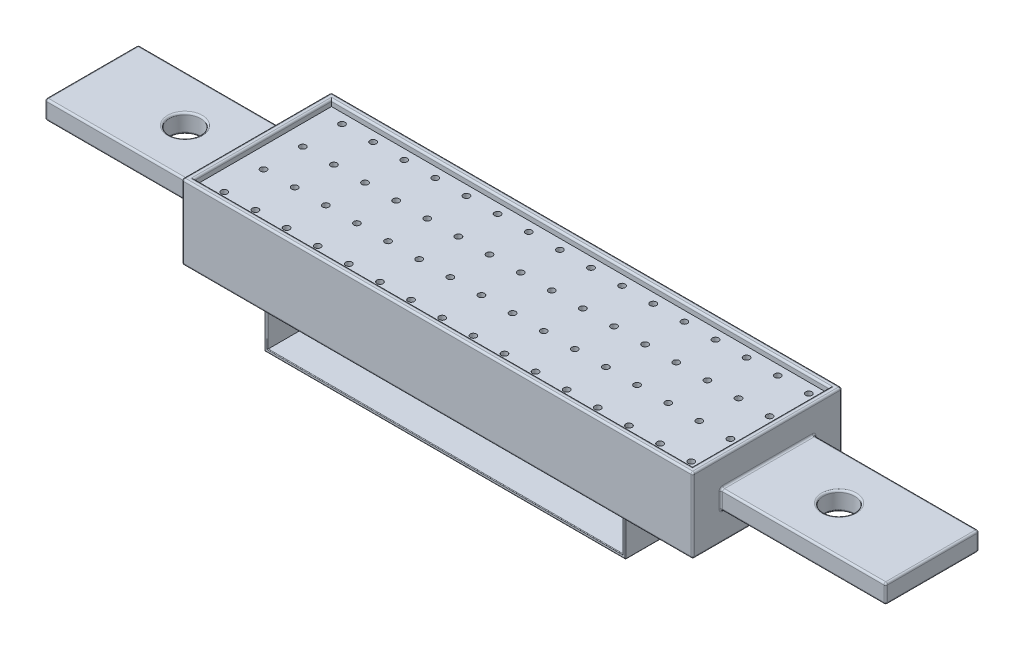
from build123d import *

# Parameters (mm, degrees)
SKETCH1_W           = 80
SKETCH1_H           = 22
SKETCH1_R           = 0.5
BOSS_EXTRUDE1_DEPTH = 10
BOSS_EXTRUDE2_START = -1
SKETCH6_W           = 82
SKETCH6_H           = 24
SKETCH6_W_2         = 80
SKETCH6_H_2         = 22
BOSS_EXTRUDE2_DEPTH = 12
SKETCH7_W           = 15
SKETCH7_H           = 3
BOSS_EXTRUDE3_DEPTH = 26.5
SKETCH8_R           = 2.5
CUT_EXTRUDE1_DEPTH  = 111.232726826
FILLET1_R           = 0.3
SKETCH10_W          = 58
SKETCH10_H          = 21
BOSS_EXTRUDE4_DEPTH = 7
SHELL1_T            = -0.5
FILLET2_R           = 0.1


with BuildPart() as part:
    # Sketch1 → Boss-Extrude1 (new body)
    with BuildSketch(Plane(origin=(0, 0, 0), x_dir=(1, 0, 0), z_dir=(0, 1, 0))):
        with Locations((40, 11)):
            Rectangle(SKETCH1_W, SKETCH1_H)
        with Locations(Location((78.276716264, 1.510550974, 0), (0, 0, 270))):
            Circle(SKETCH1_R, mode=Mode.SUBTRACT)
        with Locations(Location((73.276716264, 1.510550974, 0), (0, 0, 270))):
            Circle(SKETCH1_R, mode=Mode.SUBTRACT)
        with Locations(Location((68.276716264, 1.510550974, 0), (0, 0, 270))):
            Circle(SKETCH1_R, mode=Mode.SUBTRACT)
        with Locations(Location((63.276716264, 1.510550974, 0), (0, 0, 270))):
            Circle(SKETCH1_R, mode=Mode.SUBTRACT)
        with Locations(Location((58.276716264, 1.510550974, 0), (0, 0, 270))):
            Circle(SKETCH1_R, mode=Mode.SUBTRACT)
        with Locations(Location((53.276716264, 1.510550974, 0), (0, 0, 270))):
            Circle(SKETCH1_R, mode=Mode.SUBTRACT)
        with Locations(Location((48.276716264, 1.510550974, 0), (0, 0, 270))):
            Circle(SKETCH1_R, mode=Mode.SUBTRACT)
        with Locations(Location((43.276716264, 1.510550974, 0), (0, 0, 270))):
            Circle(SKETCH1_R, mode=Mode.SUBTRACT)
        with Locations(Location((38.276716264, 1.510550974, 0), (0, 0, 270))):
            Circle(SKETCH1_R, mode=Mode.SUBTRACT)
        with Locations(Location((33.276716264, 1.510550974, 0), (0, 0, 270))):
            Circle(SKETCH1_R, mode=Mode.SUBTRACT)
        with Locations(Location((28.276716264, 1.510550974, 0), (0, 0, 270))):
            Circle(SKETCH1_R, mode=Mode.SUBTRACT)
        with Locations(Location((23.276716264, 1.510550974, 0), (0, 0, 270))):
            Circle(SKETCH1_R, mode=Mode.SUBTRACT)
        with Locations(Location((18.276716264, 1.510550974, 0), (0, 0, 270))):
            Circle(SKETCH1_R, mode=Mode.SUBTRACT)
        with Locations(Location((13.276716264, 1.510550974, 0), (0, 0, 270))):
            Circle(SKETCH1_R, mode=Mode.SUBTRACT)
        with Locations(Location((8.276716264, 1.510550974, 0), (0, 0, 270))):
            Circle(SKETCH1_R, mode=Mode.SUBTRACT)
        with Locations(Location((3.276716264, 1.510550974, 0), (0, 0, 270))):
            Circle(SKETCH1_R, mode=Mode.SUBTRACT)
        with Locations(Location((73.276716264, 7.810550974, 0), (0, 0, 270))):
            Circle(SKETCH1_R, mode=Mode.SUBTRACT)
        with Locations(Location((68.276716264, 7.810550974, 0), (0, 0, 270))):
            Circle(SKETCH1_R, mode=Mode.SUBTRACT)
        with Locations(Location((63.276716264, 7.810550974, 0), (0, 0, 270))):
            Circle(SKETCH1_R, mode=Mode.SUBTRACT)
        with Locations(Location((58.276716264, 7.810550974, 0), (0, 0, 270))):
            Circle(SKETCH1_R, mode=Mode.SUBTRACT)
        with Locations(Location((53.276716264, 7.810550974, 0), (0, 0, 270))):
            Circle(SKETCH1_R, mode=Mode.SUBTRACT)
        with Locations(Location((48.276716264, 7.810550974, 0), (0, 0, 270))):
            Circle(SKETCH1_R, mode=Mode.SUBTRACT)
        with Locations(Location((43.276716264, 7.810550974, 0), (0, 0, 270))):
            Circle(SKETCH1_R, mode=Mode.SUBTRACT)
        with Locations(Location((38.276716264, 7.810550974, 0), (0, 0, 270))):
            Circle(SKETCH1_R, mode=Mode.SUBTRACT)
        with Locations(Location((33.276716264, 7.810550974, 0), (0, 0, 270))):
            Circle(SKETCH1_R, mode=Mode.SUBTRACT)
        with Locations(Location((28.276716264, 7.810550974, 0), (0, 0, 270))):
            Circle(SKETCH1_R, mode=Mode.SUBTRACT)
        with Locations(Location((23.276716264, 7.810550974, 0), (0, 0, 270))):
            Circle(SKETCH1_R, mode=Mode.SUBTRACT)
        with Locations(Location((18.276716264, 7.810550974, 0), (0, 0, 270))):
            Circle(SKETCH1_R, mode=Mode.SUBTRACT)
        with Locations(Location((13.276716264, 7.810550974, 0), (0, 0, 270))):
            Circle(SKETCH1_R, mode=Mode.SUBTRACT)
        with Locations(Location((8.276716264, 7.810550974, 0), (0, 0, 270))):
            Circle(SKETCH1_R, mode=Mode.SUBTRACT)
        with Locations(Location((3.276716264, 7.810550974, 0), (0, 0, 270))):
            Circle(SKETCH1_R, mode=Mode.SUBTRACT)
        with Locations(Location((73.276716264, 14.110550974, 0), (0, 0, 270))):
            Circle(SKETCH1_R, mode=Mode.SUBTRACT)
        with Locations(Location((68.276716264, 14.110550974, 0), (0, 0, 270))):
            Circle(SKETCH1_R, mode=Mode.SUBTRACT)
        with Locations(Location((63.276716264, 14.110550974, 0), (0, 0, 270))):
            Circle(SKETCH1_R, mode=Mode.SUBTRACT)
        with Locations(Location((58.276716264, 14.110550974, 0), (0, 0, 270))):
            Circle(SKETCH1_R, mode=Mode.SUBTRACT)
        with Locations(Location((53.276716264, 14.110550974, 0), (0, 0, 270))):
            Circle(SKETCH1_R, mode=Mode.SUBTRACT)
        with Locations(Location((48.276716264, 14.110550974, 0), (0, 0, 270))):
            Circle(SKETCH1_R, mode=Mode.SUBTRACT)
        with Locations(Location((43.276716264, 14.110550974, 0), (0, 0, 270))):
            Circle(SKETCH1_R, mode=Mode.SUBTRACT)
        with Locations(Location((38.276716264, 14.110550974, 0), (0, 0, 270))):
            Circle(SKETCH1_R, mode=Mode.SUBTRACT)
        with Locations(Location((33.276716264, 14.110550974, 0), (0, 0, 270))):
            Circle(SKETCH1_R, mode=Mode.SUBTRACT)
        with Locations(Location((28.276716264, 14.110550974, 0), (0, 0, 270))):
            Circle(SKETCH1_R, mode=Mode.SUBTRACT)
        with Locations(Location((23.276716264, 14.110550974, 0), (0, 0, 270))):
            Circle(SKETCH1_R, mode=Mode.SUBTRACT)
        with Locations(Location((18.276716264, 14.110550974, 0), (0, 0, 270))):
            Circle(SKETCH1_R, mode=Mode.SUBTRACT)
        with Locations(Location((13.276716264, 14.110550974, 0), (0, 0, 270))):
            Circle(SKETCH1_R, mode=Mode.SUBTRACT)
        with Locations(Location((8.276716264, 14.110550974, 0), (0, 0, 270))):
            Circle(SKETCH1_R, mode=Mode.SUBTRACT)
        with Locations(Location((3.276716264, 14.110550974, 0), (0, 0, 270))):
            Circle(SKETCH1_R, mode=Mode.SUBTRACT)
        with Locations(Location((73.276716264, 20.410550974, 0), (0, 0, 270))):
            Circle(SKETCH1_R, mode=Mode.SUBTRACT)
        with Locations(Location((68.276716264, 20.410550974, 0), (0, 0, 270))):
            Circle(SKETCH1_R, mode=Mode.SUBTRACT)
        with Locations(Location((63.276716264, 20.410550974, 0), (0, 0, 270))):
            Circle(SKETCH1_R, mode=Mode.SUBTRACT)
        with Locations(Location((58.276716264, 20.410550974, 0), (0, 0, 270))):
            Circle(SKETCH1_R, mode=Mode.SUBTRACT)
        with Locations(Location((53.276716264, 20.410550974, 0), (0, 0, 270))):
            Circle(SKETCH1_R, mode=Mode.SUBTRACT)
        with Locations(Location((48.276716264, 20.410550974, 0), (0, 0, 270))):
            Circle(SKETCH1_R, mode=Mode.SUBTRACT)
        with Locations(Location((43.276716264, 20.410550974, 0), (0, 0, 270))):
            Circle(SKETCH1_R, mode=Mode.SUBTRACT)
        with Locations(Location((38.276716264, 20.410550974, 0), (0, 0, 270))):
            Circle(SKETCH1_R, mode=Mode.SUBTRACT)
        with Locations(Location((33.276716264, 20.410550974, 0), (0, 0, 270))):
            Circle(SKETCH1_R, mode=Mode.SUBTRACT)
        with Locations(Location((28.276716264, 20.410550974, 0), (0, 0, 270))):
            Circle(SKETCH1_R, mode=Mode.SUBTRACT)
        with Locations(Location((23.276716264, 20.410550974, 0), (0, 0, 270))):
            Circle(SKETCH1_R, mode=Mode.SUBTRACT)
        with Locations(Location((18.276716264, 20.410550974, 0), (0, 0, 270))):
            Circle(SKETCH1_R, mode=Mode.SUBTRACT)
        with Locations(Location((13.276716264, 20.410550974, 0), (0, 0, 270))):
            Circle(SKETCH1_R, mode=Mode.SUBTRACT)
        with Locations(Location((8.276716264, 20.410550974, 0), (0, 0, 270))):
            Circle(SKETCH1_R, mode=Mode.SUBTRACT)
        with Locations(Location((3.276716264, 20.410550974, 0), (0, 0, 270))):
            Circle(SKETCH1_R, mode=Mode.SUBTRACT)
        with Locations(Location((78.276716264, 7.810550974, 0), (0, 0, 270))):
            Circle(SKETCH1_R, mode=Mode.SUBTRACT)
        with Locations(Location((78.276716264, 14.110550974, 0), (0, 0, 270))):
            Circle(SKETCH1_R, mode=Mode.SUBTRACT)
        with Locations(Location((78.276716264, 20.410550974, 0), (0, 0, 270))):
            Circle(SKETCH1_R, mode=Mode.SUBTRACT)
    extrude(amount=BOSS_EXTRUDE1_DEPTH)

    # Sketch6 → Boss-Extrude2 (add)
    with BuildSketch(Plane(origin=(0, 0, 0), x_dir=(1, 0, 0), z_dir=(0, 1, 0)).offset(BOSS_EXTRUDE2_START)):
        with Locations((39.962392669, 11)):
            Rectangle(SKETCH6_W, SKETCH6_H)
        with Locations((40, 11)):
            Rectangle(SKETCH6_W_2, SKETCH6_H_2, mode=Mode.SUBTRACT)
    boss_extrude2 = extrude(amount=BOSS_EXTRUDE2_DEPTH)

    # Sketch7 → Boss-Extrude3 (add)
    with BuildSketch(Plane.ZY.offset(1.037607331)):
        with Locations((-11, 5.110326736)):
            Rectangle(SKETCH7_W, SKETCH7_H)
    boss_extrude3 = extrude(amount=BOSS_EXTRUDE3_DEPTH)

    # Mirror2: Boss-Extrude2, Boss-Extrude3 across plane
    add(boss_extrude2.mirror(Plane(origin=(40, 0, 0), x_dir=(0, 0, 1), z_dir=(1, 0, 0))))
    add(boss_extrude3.mirror(Plane(origin=(40, 0, 0), x_dir=(0, 0, 1), z_dir=(1, 0, 0))))

    # Sketch8 → Cut-Extrude1 (cut, through all)
    with BuildSketch(Plane(origin=(0, 6.610326736, 0), x_dir=(1, 0, 0), z_dir=(0, 1, 0))):
        with Locations(Location((-12.537607331, 11, 0), (0, 0, 270))):
            Circle(SKETCH8_R)
    cut_extrude1 = extrude(amount=-CUT_EXTRUDE1_DEPTH, mode=Mode.SUBTRACT)

    # Mirror3: Cut-Extrude1 across plane
    add(cut_extrude1.mirror(Plane(origin=(40, 0, 0), x_dir=(0, 0, 1), z_dir=(1, 0, 0))), mode=Mode.SUBTRACT)

    # Fillet1
    fillet1_edges = [part.edges().sort_by_distance(p)[0] for p in [
        (40, 11, 0),
        (40, 11, -22),
        (80, 11, -11),
        (0, 11, -11),
        (-1.037607331, 5, 1),
        (-1.037607331, -1, -11),
        (-1.037607331, 5, -23),
        (40, -1, -23),
        (40, -1, 1),
        (80, -1, -11),
        (40, -1, -22),
        (0, -1, -11),
        (40, -1, 0),
        (-1.037607331, 11, -11),
        (40, 11, 1),
        (40, 11, -23),
        (-1.037607331, 5.110326736, -3.5),
        (-14.287607331, 3.610326736, -3.5),
        (-1.037607331, 6.610326736, -11),
        (-14.287607331, 6.610326736, -3.5),
        (-1.037607331, 5.110326736, -18.5),
        (-14.287607331, 6.610326736, -18.5),
        (-1.037607331, 3.610326736, -11),
        (-14.287607331, 3.610326736, -18.5),
        (-27.537607331, 5.110326736, -3.5),
        (-27.537607331, 6.610326736, -11),
        (-27.537607331, 5.110326736, -18.5),
        (-27.537607331, 3.610326736, -11),
        (81.037607331, -1, -11),
        (81.037607331, 5, -23),
        (81.037607331, 11, -11),
        (81.037607331, 5, 1),
        (107.537607331, 5.110326736, -3.5),
        (94.287607331, 6.610326736, -3.5),
        (107.537607331, 3.610326736, -11),
        (94.287607331, 3.610326736, -3.5),
        (107.537607331, 5.110326736, -18.5),
        (94.287607331, 3.610326736, -18.5),
        (107.537607331, 6.610326736, -11),
        (94.287607331, 6.610326736, -18.5),
        (81.037607331, 5.110326736, -3.5),
        (81.037607331, 6.610326736, -11),
        (81.037607331, 5.110326736, -18.5),
        (81.037607331, 3.610326736, -11),
        (-12.537607331, 3.610326736, -13.5),
        (-12.537607331, 6.610326736, -13.5),
        (92.537607331, 3.610326736, -13.5),
        (92.537607331, 6.610326736, -13.5),
    ]]
    fillet(fillet1_edges, radius=FILLET1_R)


with BuildPart() as body_2:
    # Sketch10 → Boss-Extrude4 (new body)
    with BuildSketch(Plane(origin=(0, -1, 0), x_dir=(1, 0, 0), z_dir=(0, 1, 0))):
        with Locations((39.64282027, 11.115707248)):
            Rectangle(SKETCH10_W, SKETCH10_H)
    extrude(amount=-BOSS_EXTRUDE4_DEPTH)

    # Shell1
    shell1_openings = [body_2.faces().sort_by_distance(p)[0] for p in [
        (39.64282027, -4.5, -0.615707248),
    ]]
    offset(amount=SHELL1_T, openings=shell1_openings, kind=Kind.INTERSECTION)

    # Fillet2
    fillet2_edges = [body_2.edges().sort_by_distance(p)[0] for p in [
        (68.64282027, -8, -11.115707248),
        (39.64282027, -8, -21.615707248),
        (11.14282027, -4.5, -0.615707248),
        (39.64282027, -7.5, -0.615707248),
        (68.14282027, -4.5, -0.615707248),
        (39.64282027, -1.5, -0.615707248),
        (10.64282027, -8, -11.115707248),
        (39.64282027, -8, -0.615707248),
        (10.64282027, -4.5, -21.615707248),
        (68.64282027, -4.5, -21.615707248),
        (68.64282027, -4.5, -0.615707248),
        (10.64282027, -4.5, -0.615707248),
    ]]
    fillet(fillet2_edges, radius=FILLET2_R)


solid = Compound([part.part, body_2.part])
